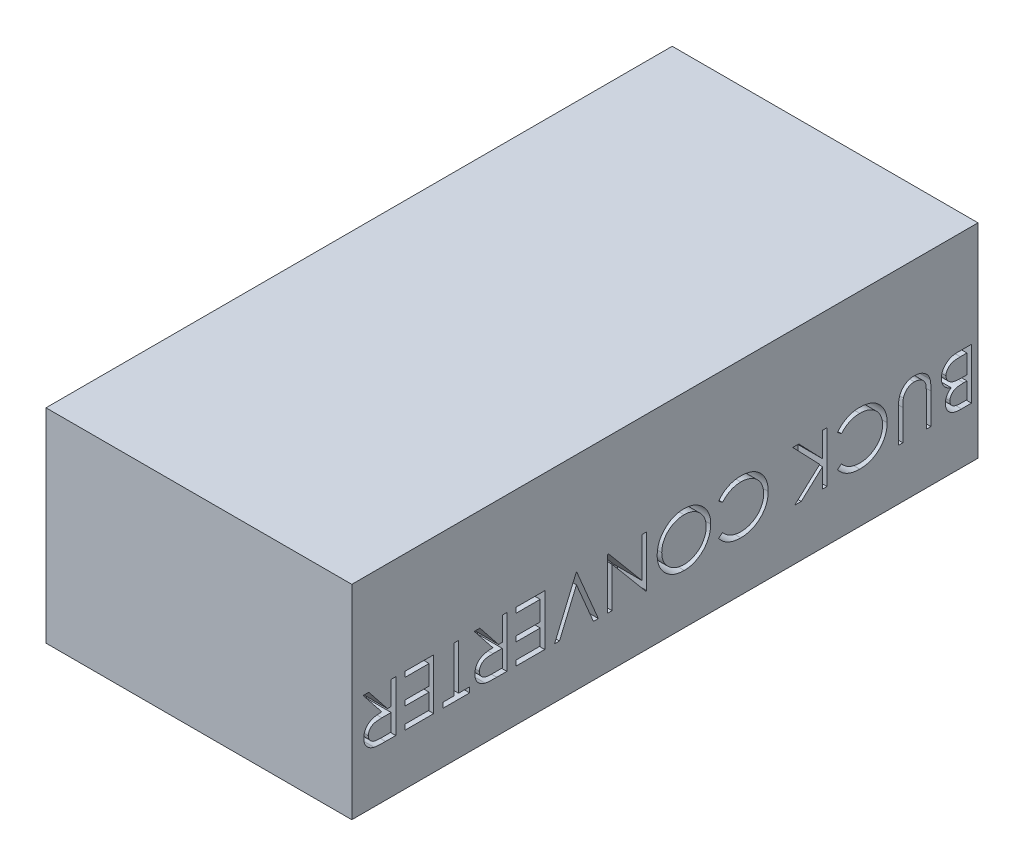
from build123d import *

# Parameters (mm, degrees)
SKETCH1_W           = 21
SKETCH1_H           = 43
BOSS_EXTRUDE1_DEPTH = 14
CUT_EXTRUDE1_DEPTH  = 2


with BuildPart() as part:
    # Sketch1 → Boss-Extrude1 (new body)
    with BuildSketch(Plane(origin=(0, 0, 0), x_dir=(1, 0, 0), z_dir=(0, 1, 0))):
        Rectangle(SKETCH1_W, SKETCH1_H)
    extrude(amount=BOSS_EXTRUDE1_DEPTH)

    # Sketch2 → Cut-Extrude1 (cut)
    # profile 1 of 13: a face of its own
    with BuildSketch(Plane(origin=(10.5, 0, 0), x_dir=(0, 0, -1), z_dir=(1, 0, 0))):
        with BuildLine():
            Line((21.051282051, 3.5), (20.368389423, 3.5))
            add(Edge.make_bspline(
                [(20.368389423, 3.5), (20.334960418, 3.500172984), (20.270166686, 3.500508269), (20.175954408, 3.505829002), (20.087680778, 3.512902413), (20.005501786, 3.52476768), (19.928882705, 3.537070397), (19.85860138, 3.55512784), (19.794069117, 3.575072944), (19.716579078, 3.605761192), (19.628656011, 3.653420429), (19.534155165, 3.724103607), (19.452009264, 3.808847029), (19.382160899, 3.905418843), (19.3261061, 4.011658782), (19.286065965, 4.125281059), (19.260342658, 4.244374116), (19.257730433, 4.326023418), (19.256410256, 4.36728766)],
                knots=[0, 0, 0, 0, 1.00128172, 1.940733171, 2.826250472, 3.653024905, 4.427672124, 5.149348099, 5.824709082, 6.450061444, 7.643590664, 8.808605388, 9.972104426, 11.165284501, 12.367876273, 13.557044126, 14.765369432, 16, 16, 16, 16], degree=3))
            add(Edge.make_bspline(
                [(19.256410256, 4.36728766), (19.257488595, 4.405945152), (19.259607633, 4.481910769), (19.280308915, 4.592646797), (19.311556998, 4.698389778), (19.356649879, 4.798120669), (19.414147093, 4.890963139), (19.484101093, 4.975333531), (19.567047364, 5.049575379), (19.629323882, 5.090892023), (19.660957532, 5.111879006)],
                knots=[0, 0, 0, 0, 1.044356178, 2.052258378, 3.035953355, 4.020338374, 5.002448483, 5.980768927, 6.974322109, 8, 8, 8, 8], degree=3))
            add(Edge.make_bspline(
                [(19.660957532, 5.111879006), (19.621194283, 5.127137161), (19.545117337, 5.156329791), (19.440290155, 5.208141918), (19.349943956, 5.264063583), (19.272914422, 5.324504675), (19.208369116, 5.391438768), (19.150869565, 5.463103107), (19.102071463, 5.541993518), (19.060435796, 5.626400483), (19.027453731, 5.715877014), (19.004559592, 5.80975372), (18.990040056, 5.906967318), (18.988141362, 5.973038748), (18.987179487, 6.006510417)],
                knots=[0, 0, 0, 0, 1.272200328, 2.434034374, 3.488177493, 4.442517805, 5.351202203, 6.260825393, 7.183200622, 8.11705787, 9.069326169, 10.026320267, 11.000137371, 12, 12, 12, 12], degree=3))
            add(Edge.make_bspline(
                [(18.987179487, 6.006510417), (18.988156427, 6.040677232), (18.990078583, 6.107901398), (19.004257216, 6.206657345), (19.028271245, 6.301029308), (19.061324283, 6.391645467), (19.104410582, 6.477975111), (19.156463308, 6.560696694), (19.218937559, 6.638584271), (19.28928971, 6.712768085), (19.36778247, 6.780605978), (19.45427535, 6.838903633), (19.546551628, 6.889257714), (19.645874917, 6.929739572), (19.751540451, 6.961429461), (19.863572984, 6.983339798), (19.981908898, 6.998162279), (20.063119828, 6.999377032), (20.104767628, 7)],
                knots=[0, 0, 0, 0, 0.978522333, 1.925270105, 2.85076145, 3.763600118, 4.682725947, 5.609499657, 6.557784645, 7.537954401, 8.534920712, 9.522742111, 10.520247711, 11.5409147, 12.58930695, 13.675078472, 14.807699069, 16, 16, 16, 16], degree=3))
            Line((20.104767628, 7), (21.051282051, 7))
            Line((21.051282051, 7), (21.051282051, 3.5))
        make_face()
        with BuildLine():
            Line((20.737179487, 3.858974359), (20.737179487, 4.980769231))
            Line((20.737179487, 4.980769231), (20.526141827, 4.980769231))
            add(Edge.make_bspline(
                [(20.526141827, 4.980769231), (20.495292754, 4.980372636), (20.435686058, 4.979606334), (20.349136767, 4.977342054), (20.268999446, 4.971279619), (20.194997971, 4.964867583), (20.127628276, 4.954994401), (20.066665012, 4.942912271), (20.011559933, 4.930246421), (19.94804245, 4.908643943), (19.876002732, 4.87705194), (19.799744047, 4.826823143), (19.731107802, 4.768669055), (19.674486862, 4.699689219), (19.627347874, 4.625197235), (19.595611023, 4.544637613), (19.573482911, 4.46078646), (19.571512992, 4.402958368), (19.570512821, 4.373597756)],
                knots=[0, 0, 0, 0, 1.156584208, 2.234756387, 3.244705828, 4.168772894, 5.018724976, 5.795346628, 6.498686023, 7.135894168, 8.308330183, 9.43588092, 10.547699294, 11.667188675, 12.76860303, 13.837480448, 14.902040606, 16, 16, 16, 16], degree=3))
            add(Edge.make_bspline(
                [(19.570512821, 4.373597756), (19.57100062, 4.354160391), (19.571957493, 4.316031875), (19.580978311, 4.260480817), (19.593426932, 4.207618164), (19.613957809, 4.158868998), (19.638281591, 4.112521538), (19.66945887, 4.070039811), (19.705409142, 4.030272982), (19.747322652, 3.994286964), (19.795028068, 3.961739688), (19.850036584, 3.934645635), (19.910852653, 3.91056748), (19.97874448, 3.892315675), (20.052359721, 3.876470202), (20.132821484, 3.866478135), (20.219644851, 3.860059073), (20.279801452, 3.859343995), (20.310897436, 3.858974359)],
                knots=[0, 0, 0, 0, 0.911412742, 1.787835618, 2.63643285, 3.453173233, 4.262886967, 5.08783453, 5.918594724, 6.773969545, 7.67442701, 8.62112486, 9.645634318, 10.739428598, 11.916091468, 13.177237585, 14.540865421, 16, 16, 16, 16], degree=3))
            Line((20.310897436, 3.858974359), (20.737179487, 3.858974359))
        make_face(mode=Mode.SUBTRACT)
        with BuildLine():
            Line((20.737179487, 5.33974359), (20.737179487, 6.641025641))
            Line((20.737179487, 6.641025641), (20.289863782, 6.641025641))
            add(Edge.make_bspline(
                [(20.289863782, 6.641025641), (20.257848057, 6.640604993), (20.196141968, 6.639794251), (20.106981197, 6.63787047), (20.02478179, 6.630733251), (19.948859351, 6.623890525), (19.879565166, 6.612711512), (19.816225231, 6.60188637), (19.760286259, 6.585956638), (19.69483443, 6.564037046), (19.621627218, 6.529006631), (19.541681488, 6.477491407), (19.47126593, 6.414742066), (19.411523263, 6.342489763), (19.361849855, 6.264740239), (19.327485667, 6.181340468), (19.305219629, 6.095076139), (19.302597219, 6.036091755), (19.301282051, 6.006510417)],
                knots=[0, 0, 0, 0, 1.16016216, 2.236059617, 3.229676189, 4.14889023, 4.996733752, 5.772278665, 6.474820656, 7.101410824, 8.271817372, 9.403828207, 10.537358096, 11.673541442, 12.791884111, 13.865947414, 14.929748409, 16, 16, 16, 16], degree=3))
            add(Edge.make_bspline(
                [(19.301282051, 6.006510417), (19.301550517, 5.988014302), (19.302083119, 5.951320418), (19.310455091, 5.897445038), (19.322073246, 5.844998886), (19.339195144, 5.794694354), (19.359907985, 5.745665208), (19.387233498, 5.699506765), (19.418056476, 5.654254134), (19.465796606, 5.596371008), (19.536181938, 5.530484909), (19.636237171, 5.466784366), (19.749367359, 5.414579785), (19.831612726, 5.392510301), (19.874098558, 5.381109776)],
                knots=[0, 0, 0, 0, 0.723354195, 1.435040621, 2.129761981, 2.824182007, 3.512608497, 4.209435533, 4.920062464, 5.654614313, 7.143585817, 8.671381114, 10.280521501, 12, 12, 12, 12], degree=3))
            add(Edge.make_bspline(
                [(19.874098558, 5.381109776), (19.891127638, 5.377654459), (19.928050196, 5.370162621), (19.988258082, 5.362259384), (20.057224435, 5.355169923), (20.134654481, 5.35006353), (20.220856169, 5.344581907), (20.315801805, 5.342525963), (20.419558513, 5.340016576), (20.491550974, 5.339836913), (20.528946314, 5.33974359)],
                knots=[0, 0, 0, 0, 0.634452549, 1.375623993, 2.216454381, 3.166361212, 4.209414599, 5.370755378, 6.634280627, 8, 8, 8, 8], degree=3))
            Line((20.528946314, 5.33974359), (20.737179487, 5.33974359))
        make_face(mode=Mode.SUBTRACT)
    # profile 2 of 13: a face of its own
    with BuildSketch(Plane(origin=(10.5, 0, 0), x_dir=(0, 0, -1), z_dir=(1, 0, 0))):
        with BuildLine():
            Line((18.269230769, 3.5), (17.955128205, 3.5))
            Line((17.955128205, 3.5), (17.955128205, 5.597055288))
            add(Edge.make_bspline(
                [(17.955128205, 5.597055288), (17.955174949, 5.626736024), (17.955263654, 5.683060335), (17.95467114, 5.763228636), (17.953011772, 5.834501095), (17.951965612, 5.897152442), (17.949638278, 5.95089519), (17.947740232, 5.9960205), (17.945299675, 6.032314703), (17.942366557, 6.053495629), (17.941105769, 6.06260016)],
                knots=[0, 0, 0, 0, 1.528628734, 2.90083645, 4.128790002, 5.200304208, 6.127813768, 6.898992206, 7.526736466, 8, 8, 8, 8], degree=3))
            add(Edge.make_bspline(
                [(17.941105769, 6.06260016), (17.935992373, 6.095701677), (17.926121192, 6.159602666), (17.899800503, 6.250486033), (17.864997624, 6.332829027), (17.820644397, 6.407551663), (17.765940393, 6.475179324), (17.69844651, 6.5363622), (17.618302052, 6.591276556), (17.527329354, 6.639446207), (17.430337919, 6.679397119), (17.330877037, 6.709305362), (17.230846673, 6.727605904), (17.163868855, 6.729719607), (17.130608974, 6.730769231)],
                knots=[0, 0, 0, 0, 1.042923073, 2.013316119, 2.939979093, 3.821796737, 4.712412725, 5.640305549, 6.650442997, 7.732186751, 8.842579391, 9.91407549, 10.964170509, 12, 12, 12, 12], degree=3))
            add(Edge.make_bspline(
                [(17.130608974, 6.730769231), (17.102052672, 6.729701392), (17.045105, 6.727571883), (16.960536728, 6.714220914), (16.877908096, 6.690638524), (16.797886048, 6.6584976), (16.721704703, 6.61903586), (16.651412244, 6.571434275), (16.587748919, 6.51679487), (16.530336519, 6.455373621), (16.480364283, 6.386794141), (16.437345758, 6.311413734), (16.402197347, 6.228631172), (16.38454004, 6.170290699), (16.375500801, 6.140424679)],
                knots=[0, 0, 0, 0, 0.994543961, 1.983343699, 2.972712664, 3.980751554, 4.981834161, 5.954730495, 6.930176574, 7.89761099, 8.875938748, 9.87834379, 10.913868493, 12, 12, 12, 12], degree=3))
            add(Edge.make_bspline(
                [(16.375500801, 6.140424679), (16.372500676, 6.128076105), (16.365815188, 6.100558505), (16.359568143, 6.054037215), (16.353061617, 5.999147851), (16.348547047, 5.935496038), (16.344145827, 5.863295065), (16.341512754, 5.782168808), (16.340295721, 5.692411847), (16.339933041, 5.629774685), (16.33974359, 5.597055288)],
                knots=[0, 0, 0, 0, 0.558680831, 1.244966039, 2.062412453, 2.990489873, 4.051219941, 5.244515665, 6.560634259, 8, 8, 8, 8], degree=3))
            Line((16.33974359, 5.597055288), (16.33974359, 3.5))
            Line((16.33974359, 3.5), (16.025641026, 3.5))
            Line((16.025641026, 3.5), (16.025641026, 5.613882212))
            add(Edge.make_bspline(
                [(16.025641026, 5.613882212), (16.025892372, 5.651980994), (16.02638289, 5.726333084), (16.030722001, 5.83527884), (16.037442871, 5.938651613), (16.047595217, 6.036321365), (16.058828703, 6.128398013), (16.074765444, 6.214544305), (16.091713725, 6.295491065), (16.112983583, 6.371387599), (16.138285268, 6.443379087), (16.168415946, 6.512825305), (16.205113397, 6.57910143), (16.24665256, 6.643422424), (16.293883913, 6.705195523), (16.346404725, 6.764900078), (16.405055613, 6.821751189), (16.468358403, 6.876020652), (16.535799145, 6.926848433), (16.608134461, 6.97012412), (16.684069532, 7.006748991), (16.762799021, 7.037943323), (16.845653573, 7.060754244), (16.931601151, 7.077880318), (17.021245797, 7.08756858), (17.082209703, 7.08901244), (17.113080929, 7.08974359)],
                knots=[0, 0, 0, 0, 1.316485072, 2.56920066, 3.767172097, 4.895413872, 5.962239305, 6.971350037, 7.921780903, 8.819233545, 9.69278517, 10.557066787, 11.431700348, 12.307563454, 13.200791052, 14.11626757, 15.05287325, 16.020813301, 16.99640464, 17.967304965, 18.928075993, 19.907403966, 20.889159767, 21.893313923, 22.933205135, 24, 24, 24, 24], degree=3))
            add(Edge.make_bspline(
                [(17.113080929, 7.08974359), (17.146750278, 7.088959368), (17.212809419, 7.087420729), (17.310144004, 7.078590276), (17.403470893, 7.061999951), (17.493700932, 7.04073864), (17.5799624, 7.011894136), (17.662229875, 6.976451935), (17.741447959, 6.935989276), (17.815831888, 6.888176266), (17.885991858, 6.836039397), (17.949751228, 6.778772763), (18.008728536, 6.718557371), (18.060324194, 6.653125808), (18.106489722, 6.583817519), (18.146207838, 6.510306514), (18.180324311, 6.432691338), (18.19793044, 6.378737711), (18.206830929, 6.35146234)],
                knots=[0, 0, 0, 0, 1.138939089, 2.234594419, 3.301501784, 4.342532435, 5.367382236, 6.373123747, 7.370098489, 8.372230273, 9.360297234, 10.323289009, 11.268038109, 12.20748145, 13.137029304, 14.081414587, 15.030090602, 16, 16, 16, 16], degree=3))
            add(Edge.make_bspline(
                [(18.206830929, 6.35146234), (18.212008088, 6.332829765), (18.223237459, 6.292415296), (18.235262757, 6.225528808), (18.245371838, 6.14851389), (18.254877397, 6.061365272), (18.260486355, 5.964015405), (18.265403793, 5.856506489), (18.269265412, 5.738708528), (18.26924264, 5.656654012), (18.269230769, 5.613882212)],
                knots=[0, 0, 0, 0, 0.625038921, 1.35572334, 2.194682327, 3.136881307, 4.189498639, 5.346923369, 6.617055217, 8, 8, 8, 8], degree=3))
            Line((18.269230769, 5.613882212), (18.269230769, 3.5))
        make_face()
    # profile 3 of 13: a face of its own
    with BuildSketch(Plane(origin=(10.5, 0, 0), x_dir=(0, 0, -1), z_dir=(1, 0, 0))):
        with BuildLine():
            Line((11.852564103, 4.142227564), (12.127403846, 4.352564103))
            add(Edge.make_bspline(
                [(12.127403846, 4.352564103), (12.147009936, 4.329198442), (12.185957782, 4.28278214), (12.24861403, 4.217598054), (12.313926723, 4.156549782), (12.381804985, 4.09924508), (12.453819677, 4.047987144), (12.527226836, 3.998783962), (12.60469367, 3.955704883), (12.711271534, 3.903078399), (12.851237191, 3.849360057), (13.026822033, 3.803157646), (13.210367852, 3.774023468), (13.335560666, 3.770846635), (13.399238782, 3.769230769)],
                knots=[0, 0, 0, 0, 0.75789156, 1.505565099, 2.245254514, 2.979266606, 3.711207489, 4.440978832, 5.174393176, 5.91211879, 7.394186119, 8.890401545, 10.418332761, 12, 12, 12, 12], degree=3))
            add(Edge.make_bspline(
                [(13.399238782, 3.769230769), (13.434321655, 3.769636555), (13.504161799, 3.770444359), (13.607816566, 3.781026584), (13.709732099, 3.79607132), (13.809529409, 3.8178517), (13.907010348, 3.846207777), (14.002917143, 3.879461891), (14.096120296, 3.920843245), (14.187741384, 3.966543484), (14.275516768, 4.018176137), (14.358583926, 4.07447701), (14.436568213, 4.134889919), (14.509667959, 4.1992721), (14.577146571, 4.268375171), (14.639720903, 4.341422716), (14.697311089, 4.418744625), (14.749857706, 4.499971447), (14.796857342, 4.584701948), (14.837613662, 4.672572174), (14.872064716, 4.763246435), (14.900013585, 4.856530407), (14.921887512, 4.952093887), (14.937028928, 5.050279044), (14.947513659, 5.150914255), (14.948314346, 5.219123359), (14.948717949, 5.253505609)],
                knots=[0, 0, 0, 0, 1.054960097, 2.100129169, 3.131228542, 4.15308236, 5.169990287, 6.183953224, 7.204064171, 8.235355279, 9.262684623, 10.264978336, 11.252191258, 12.228402777, 13.192898315, 14.155264692, 15.119862721, 16.091023151, 17.063429752, 18.032246104, 19.00241354, 19.978852882, 20.959535218, 21.948948728, 22.966123959, 24, 24, 24, 24], degree=3))
            add(Edge.make_bspline(
                [(14.948717949, 5.253505609), (14.947453171, 5.305235776), (14.944969948, 5.406801096), (14.922963615, 5.555588077), (14.889254224, 5.698262935), (14.839560183, 5.833859633), (14.777062042, 5.963508531), (14.699081594, 6.085637373), (14.60842475, 6.202035382), (14.504161485, 6.309883465), (14.389752644, 6.408395797), (14.267005534, 6.495146748), (14.136221034, 6.567461533), (13.998844461, 6.627637506), (13.853818331, 6.673894226), (13.701403533, 6.706458351), (13.541931537, 6.727700531), (13.432962137, 6.72973422), (13.377504006, 6.730769231)],
                knots=[0, 0, 0, 0, 1.029159485, 2.020618137, 2.987588728, 3.942669054, 4.889339625, 5.846988364, 6.821327795, 7.821533711, 8.827683044, 9.822769455, 10.807800696, 11.797391277, 12.803701919, 13.832062008, 14.896664671, 16, 16, 16, 16], degree=3))
            add(Edge.make_bspline(
                [(13.377504006, 6.730769231), (13.316401317, 6.729080451), (13.196136608, 6.725756528), (13.019768582, 6.697597279), (12.850932817, 6.651939362), (12.68962023, 6.588041439), (12.536285584, 6.504976151), (12.390688923, 6.404278274), (12.252707353, 6.284989941), (12.169736071, 6.193906813), (12.127403846, 6.147435897)],
                knots=[0, 0, 0, 0, 1.028121516, 2.023589091, 2.998037872, 3.967518031, 4.937445131, 5.927275754, 6.942489185, 8, 8, 8, 8], degree=3))
            Line((12.127403846, 6.147435897), (11.852564103, 6.355669071))
            add(Edge.make_bspline(
                [(11.852564103, 6.355669071), (11.874682959, 6.384206584), (11.918814723, 6.441144917), (11.990261672, 6.521430551), (12.065580314, 6.596882567), (12.144973974, 6.667108013), (12.228546297, 6.732457902), (12.316260755, 6.792628369), (12.407679859, 6.848286885), (12.50291808, 6.898734792), (12.601980632, 6.943625001), (12.70401857, 6.982858942), (12.809218808, 7.015803401), (12.916751757, 7.043483567), (13.027722316, 7.063252493), (13.140860789, 7.078985532), (13.257220564, 7.088321615), (13.335653889, 7.089265346), (13.375400641, 7.08974359)],
                knots=[0, 0, 0, 0, 0.986880684, 1.969034265, 2.935876267, 3.899990983, 4.864973347, 5.834408638, 6.8063673, 7.789580233, 8.778939794, 9.778051223, 10.776304221, 11.791326552, 12.811423977, 13.855999788, 14.91350973, 16, 16, 16, 16], degree=3))
            add(Edge.make_bspline(
                [(13.375400641, 7.08974359), (13.413044308, 7.089481597), (13.487479998, 7.088963539), (13.59737875, 7.080571372), (13.704368331, 7.069121635), (13.808142956, 7.051881504), (13.909268932, 7.031537164), (14.006829516, 7.004265907), (14.101784726, 6.973716741), (14.193753067, 6.937811754), (14.282812767, 6.897295571), (14.368676578, 6.851504013), (14.451305011, 6.800822148), (14.531510431, 6.746367137), (14.608108015, 6.686389836), (14.68176154, 6.621723201), (14.752884017, 6.55258519), (14.796886702, 6.502730337), (14.819010417, 6.477664263)],
                knots=[0, 0, 0, 0, 1.114604814, 2.203992996, 3.262667896, 4.300477797, 5.318619304, 6.316056647, 7.298880507, 8.271930387, 9.238335007, 10.195173496, 11.151986948, 12.108099108, 13.064862484, 14.031167946, 15.010108607, 16, 16, 16, 16], degree=3))
            add(Edge.make_bspline(
                [(14.819010417, 6.477664263), (14.854443749, 6.434122176), (14.924882631, 6.34756368), (15.015042345, 6.207290924), (15.091961258, 6.060964695), (15.154847275, 5.907737447), (15.203151073, 5.747549613), (15.237111783, 5.580658888), (15.259026577, 5.407398896), (15.261541939, 5.289563768), (15.262820513, 5.229667468)],
                knots=[0, 0, 0, 0, 0.994611881, 1.977215934, 2.950189954, 3.921972279, 4.908960509, 5.911694611, 6.938501887, 8, 8, 8, 8], degree=3))
            add(Edge.make_bspline(
                [(15.262820513, 5.229667468), (15.261258363, 5.166714648), (15.258184932, 5.042858906), (15.232288416, 4.861047359), (15.190123887, 4.687109692), (15.132063048, 4.520376633), (15.055465278, 4.361802165), (14.962737484, 4.210716562), (14.852973937, 4.06724319), (14.727553164, 3.933216368), (14.589978582, 3.81068028), (14.442661663, 3.702873223), (14.285879216, 3.613155932), (14.121361498, 3.538159709), (13.94787578, 3.480515263), (13.765792421, 3.440162071), (13.575453504, 3.415044956), (13.445591079, 3.411869748), (13.379607372, 3.41025641)],
                knots=[0, 0, 0, 0, 1.032901378, 2.032168977, 3.007206631, 3.966850309, 4.924221947, 5.891988639, 6.871730993, 7.884084801, 8.900290346, 9.89161143, 10.874607481, 11.860025555, 12.854717796, 13.869097222, 14.917278314, 16, 16, 16, 16], degree=3))
            add(Edge.make_bspline(
                [(13.379607372, 3.41025641), (13.339392953, 3.410738608), (13.259792561, 3.411693069), (13.142039138, 3.420998353), (13.027399645, 3.436515114), (12.915555171, 3.457661883), (12.806321235, 3.483964398), (12.700188742, 3.516898622), (12.597461793, 3.556718275), (12.497447697, 3.601036563), (12.401428802, 3.651792968), (12.309452871, 3.706962898), (12.222266731, 3.767608739), (12.139303629, 3.832845992), (12.06094713, 3.903176518), (11.986021263, 3.977418153), (11.916750743, 4.0575403), (11.873998815, 4.113946801), (11.852564103, 4.142227564)],
                knots=[0, 0, 0, 0, 1.096566765, 2.170543479, 3.218870886, 4.250164525, 5.273529809, 6.281496242, 7.278154839, 8.276706968, 9.263143576, 10.238168486, 11.199979644, 12.157579042, 13.114563119, 14.070017788, 15.032356758, 16, 16, 16, 16], degree=3))
        make_face()
    # profile 4 of 13: a face of its own
    with BuildSketch(Plane(origin=(10.5, 0, 0), x_dir=(0, 0, -1), z_dir=(1, 0, 0))):
        Polygon((11.134615385, 3.5), (10.820512821, 3.5), (10.820512821, 4.832832532), (9.361478365, 3.5), (8.913461538, 3.5), (10.633313301, 5.070512821), (8.778846154, 7), (9.197415865, 7), (10.820512821, 5.310997596), (10.820512821, 7), (11.134615385, 7), align=None)
    # profile 5 of 13: a face of its own
    with BuildSketch(Plane(origin=(10.5, 0, 0), x_dir=(0, 0, -1), z_dir=(1, 0, 0))):
        with BuildLine():
            Line((3.685897436, 4.142227564), (3.960737179, 4.352564103))
            add(Edge.make_bspline(
                [(3.960737179, 4.352564103), (3.980343269, 4.329198442), (4.019291115, 4.28278214), (4.081947364, 4.217598054), (4.147260056, 4.156549782), (4.215138319, 4.09924508), (4.287153011, 4.047987144), (4.36056017, 3.998783962), (4.438027004, 3.955704883), (4.544604867, 3.903078399), (4.684570525, 3.849360057), (4.860155367, 3.803157646), (5.043701185, 3.774023468), (5.168893999, 3.770846635), (5.232572115, 3.769230769)],
                knots=[0, 0, 0, 0, 0.75789156, 1.505565099, 2.245254514, 2.979266606, 3.711207489, 4.440978832, 5.174393176, 5.91211879, 7.394186119, 8.890401545, 10.418332761, 12, 12, 12, 12], degree=3))
            add(Edge.make_bspline(
                [(5.232572115, 3.769230769), (5.267654988, 3.769636555), (5.337495132, 3.770444359), (5.441149899, 3.781026584), (5.543065432, 3.79607132), (5.642862743, 3.8178517), (5.740343681, 3.846207777), (5.836250477, 3.879461891), (5.92945363, 3.920843245), (6.021074717, 3.966543484), (6.108850102, 4.018176137), (6.191917259, 4.07447701), (6.269901546, 4.134889919), (6.343001292, 4.1992721), (6.410479904, 4.268375171), (6.473054237, 4.341422716), (6.530644422, 4.418744625), (6.58319104, 4.499971447), (6.630190675, 4.584701948), (6.670946995, 4.672572174), (6.705398049, 4.763246435), (6.733346918, 4.856530407), (6.755220846, 4.952093887), (6.770362262, 5.050279044), (6.780846992, 5.150914255), (6.781647679, 5.219123359), (6.782051282, 5.253505609)],
                knots=[0, 0, 0, 0, 1.054960097, 2.100129169, 3.131228542, 4.15308236, 5.169990287, 6.183953224, 7.204064171, 8.235355279, 9.262684623, 10.264978336, 11.252191258, 12.228402777, 13.192898315, 14.155264692, 15.119862721, 16.091023151, 17.063429752, 18.032246104, 19.00241354, 19.978852882, 20.959535218, 21.948948728, 22.966123959, 24, 24, 24, 24], degree=3))
            add(Edge.make_bspline(
                [(6.782051282, 5.253505609), (6.780786504, 5.305235776), (6.778303281, 5.406801096), (6.756296948, 5.555588077), (6.722587557, 5.698262935), (6.672893516, 5.833859633), (6.610395375, 5.963508531), (6.532414928, 6.085637373), (6.441758083, 6.202035382), (6.337494818, 6.309883465), (6.223085977, 6.408395797), (6.100338867, 6.495146748), (5.969554367, 6.567461533), (5.832177794, 6.627637506), (5.687151665, 6.673894226), (5.534736867, 6.706458351), (5.37526487, 6.727700531), (5.26629547, 6.72973422), (5.21083734, 6.730769231)],
                knots=[0, 0, 0, 0, 1.029159485, 2.020618137, 2.987588728, 3.942669054, 4.889339625, 5.846988364, 6.821327795, 7.821533711, 8.827683044, 9.822769455, 10.807800696, 11.797391277, 12.803701919, 13.832062008, 14.896664671, 16, 16, 16, 16], degree=3))
            add(Edge.make_bspline(
                [(5.21083734, 6.730769231), (5.149734651, 6.729080451), (5.029469942, 6.725756528), (4.853101915, 6.697597279), (4.68426615, 6.651939362), (4.522953563, 6.588041439), (4.369618917, 6.504976151), (4.224022257, 6.404278274), (4.086040686, 6.284989941), (4.003069404, 6.193906813), (3.960737179, 6.147435897)],
                knots=[0, 0, 0, 0, 1.028121516, 2.023589091, 2.998037872, 3.967518031, 4.937445131, 5.927275754, 6.942489185, 8, 8, 8, 8], degree=3))
            Line((3.960737179, 6.147435897), (3.685897436, 6.355669071))
            add(Edge.make_bspline(
                [(3.685897436, 6.355669071), (3.708016292, 6.384206584), (3.752148056, 6.441144917), (3.823595006, 6.521430551), (3.898913647, 6.596882567), (3.978307308, 6.667108013), (4.06187963, 6.732457902), (4.149594088, 6.792628369), (4.241013192, 6.848286885), (4.336251414, 6.898734792), (4.435313965, 6.943625001), (4.537351903, 6.982858942), (4.642552141, 7.015803401), (4.75008509, 7.043483567), (4.861055649, 7.063252493), (4.974194122, 7.078985532), (5.090553898, 7.088321615), (5.168987223, 7.089265346), (5.208733974, 7.08974359)],
                knots=[0, 0, 0, 0, 0.986880684, 1.969034265, 2.935876267, 3.899990983, 4.864973347, 5.834408638, 6.8063673, 7.789580233, 8.778939794, 9.778051223, 10.776304221, 11.791326552, 12.811423977, 13.855999788, 14.91350973, 16, 16, 16, 16], degree=3))
            add(Edge.make_bspline(
                [(5.208733974, 7.08974359), (5.246377641, 7.089481597), (5.320813332, 7.088963539), (5.430712083, 7.080571372), (5.537701664, 7.069121635), (5.64147629, 7.051881504), (5.742602265, 7.031537164), (5.840162849, 7.004265907), (5.93511806, 6.973716741), (6.0270864, 6.937811754), (6.1161461, 6.897295571), (6.202009912, 6.851504013), (6.284638344, 6.800822148), (6.364843765, 6.746367137), (6.441441348, 6.686389836), (6.515094874, 6.621723201), (6.58621735, 6.55258519), (6.630220035, 6.502730337), (6.65234375, 6.477664263)],
                knots=[0, 0, 0, 0, 1.114604814, 2.203992996, 3.262667896, 4.300477797, 5.318619304, 6.316056647, 7.298880507, 8.271930387, 9.238335007, 10.195173496, 11.151986948, 12.108099108, 13.064862484, 14.031167946, 15.010108607, 16, 16, 16, 16], degree=3))
            add(Edge.make_bspline(
                [(6.65234375, 6.477664263), (6.687777082, 6.434122176), (6.758215964, 6.34756368), (6.848375678, 6.207290924), (6.925294591, 6.060964695), (6.988180608, 5.907737447), (7.036484406, 5.747549613), (7.070445116, 5.580658888), (7.092359911, 5.407398896), (7.094875273, 5.289563768), (7.096153846, 5.229667468)],
                knots=[0, 0, 0, 0, 0.994611881, 1.977215934, 2.950189954, 3.921972279, 4.908960509, 5.911694611, 6.938501887, 8, 8, 8, 8], degree=3))
            add(Edge.make_bspline(
                [(7.096153846, 5.229667468), (7.094591697, 5.166714648), (7.091518265, 5.042858906), (7.06562175, 4.861047359), (7.02345722, 4.687109692), (6.965396381, 4.520376633), (6.888798612, 4.361802165), (6.796070817, 4.210716562), (6.686307271, 4.06724319), (6.560886498, 3.933216368), (6.423311915, 3.81068028), (6.275994996, 3.702873223), (6.119212549, 3.613155932), (5.954694832, 3.538159709), (5.781209114, 3.480515263), (5.599125755, 3.440162071), (5.408786837, 3.415044956), (5.278924412, 3.411869748), (5.212940705, 3.41025641)],
                knots=[0, 0, 0, 0, 1.032901378, 2.032168977, 3.007206631, 3.966850309, 4.924221947, 5.891988639, 6.871730993, 7.884084801, 8.900290346, 9.89161143, 10.874607481, 11.860025555, 12.854717796, 13.869097222, 14.917278314, 16, 16, 16, 16], degree=3))
            add(Edge.make_bspline(
                [(5.212940705, 3.41025641), (5.172726286, 3.410738608), (5.093125894, 3.411693069), (4.975372471, 3.420998353), (4.860732978, 3.436515114), (4.748888504, 3.457661883), (4.639654568, 3.483964398), (4.533522076, 3.516898622), (4.430795127, 3.556718275), (4.33078103, 3.601036563), (4.234762136, 3.651792968), (4.142786205, 3.706962898), (4.055600064, 3.767608739), (3.972636963, 3.832845992), (3.894280463, 3.903176518), (3.819354597, 3.977418153), (3.750084076, 4.0575403), (3.707332148, 4.113946801), (3.685897436, 4.142227564)],
                knots=[0, 0, 0, 0, 1.096566765, 2.170543479, 3.218870886, 4.250164525, 5.273529809, 6.281496242, 7.278154839, 8.276706968, 9.263143576, 10.238168486, 11.199979644, 12.157579042, 13.114563119, 14.070017788, 15.032356758, 16, 16, 16, 16], degree=3))
        make_face()
    # profile 6 of 13: a face of its own
    with BuildSketch(Plane(origin=(10.5, 0, 0), x_dir=(0, 0, -1), z_dir=(1, 0, 0))):
        with BuildLine():
            add(Edge.make_bspline(
                [(1.330128205, 3.41025641), (1.265313046, 3.411870271), (1.138010726, 3.415040027), (0.95108902, 3.4401046), (0.772103957, 3.481359397), (0.600948636, 3.539616026), (0.438288719, 3.615152641), (0.283609945, 3.706855788), (0.137443989, 3.815626727), (0.000168897, 3.938883425), (-0.124600887, 4.074368288), (-0.233170818, 4.219820832), (-0.325573955, 4.372313506), (-0.401070621, 4.532839394), (-0.460393291, 4.700681799), (-0.501305774, 4.876840591), (-0.527445717, 5.060145972), (-0.530501248, 5.185173017), (-0.532051282, 5.248597756)],
                knots=[0, 0, 0, 0, 1.065027606, 2.091802087, 3.093458616, 4.079833113, 5.057734272, 6.036020118, 7.030157768, 8.047461502, 9.064242947, 10.052216774, 11.02588392, 11.989864716, 12.962978571, 13.945936472, 14.957997893, 16, 16, 16, 16], degree=3))
            add(Edge.make_bspline(
                [(-0.532051282, 5.248597756), (-0.530500728, 5.311554931), (-0.527444408, 5.435650815), (-0.501284535, 5.61779816), (-0.460210842, 5.792874535), (-0.401804498, 5.960472738), (-0.326252221, 6.120675058), (-0.233703687, 6.273274426), (-0.12537768, 6.419151093), (-0.001119457, 6.555295487), (0.134571538, 6.680076781), (0.279125438, 6.79038532), (0.432367811, 6.882278659), (0.591906918, 6.958903934), (0.759330528, 7.016937345), (0.933457844, 7.059227344), (1.115276184, 7.085103848), (1.23913099, 7.088180038), (1.302083333, 7.08974359)],
                knots=[0, 0, 0, 0, 1.043683505, 2.0572211, 3.045299494, 4.022276905, 4.994977706, 5.977452478, 6.97747046, 8.003698437, 9.029677512, 10.031249186, 11.013723958, 11.988083691, 12.9614021, 13.946617861, 14.956316495, 16, 16, 16, 16], degree=3))
            add(Edge.make_bspline(
                [(1.302083333, 7.08974359), (1.365507776, 7.088194411), (1.490534237, 7.085140567), (1.674069494, 7.05895618), (1.850353759, 7.01802581), (2.018844255, 6.959476378), (2.179596273, 6.884092975), (2.332594268, 6.791457967), (2.478022089, 6.682300333), (2.61439984, 6.55813969), (2.739030669, 6.422708891), (2.848650679, 6.278344793), (2.940751627, 6.126420381), (3.016166853, 5.967561916), (3.075817425, 5.802180021), (3.116526013, 5.629234381), (3.142860942, 5.449694105), (3.145895929, 5.327451313), (3.147435897, 5.265424679)],
                knots=[0, 0, 0, 0, 1.053167129, 2.076072758, 3.073341244, 4.055601477, 5.033424535, 6.017524495, 7.021518915, 8.049444456, 9.077120685, 10.074910483, 11.055688766, 12.022980584, 12.991883888, 13.970269434, 14.970104079, 16, 16, 16, 16], degree=3))
            add(Edge.make_bspline(
                [(3.147435897, 5.265424679), (3.146901752, 5.22379182), (3.1458402, 5.141051318), (3.133041294, 5.018187518), (3.114506627, 4.897286367), (3.087804597, 4.778754278), (3.053361243, 4.662571894), (3.010915653, 4.548976814), (2.96227299, 4.437033349), (2.904357181, 4.328871982), (2.841169299, 4.224322946), (2.772269264, 4.124693539), (2.69717667, 4.031763411), (2.616964199, 3.944039325), (2.53052153, 3.863018531), (2.439149622, 3.78693459), (2.342370377, 3.716575093), (2.240030735, 3.653417785), (2.134739885, 3.59540703), (2.025733935, 3.546972824), (1.915312803, 3.50416348), (1.802503856, 3.470142747), (1.687568038, 3.443068845), (1.570361669, 3.424672813), (1.451005468, 3.411845468), (1.370593984, 3.410788375), (1.330128205, 3.41025641)],
                knots=[0, 0, 0, 0, 1.037115869, 2.061148057, 3.07517727, 4.084041727, 5.086514338, 6.092668487, 7.104487461, 8.125783165, 9.147610153, 10.147694368, 11.141876323, 12.122903372, 13.107606018, 14.091946891, 15.084523921, 16.086505767, 17.087268121, 18.077809654, 19.05670789, 20.036870126, 21.011670792, 21.99694167, 22.991993299, 24, 24, 24, 24], degree=3))
        make_face()
        with BuildLine():
            add(Edge.make_bspline(
                [(1.314703526, 3.769230769), (1.34791866, 3.769634054), (1.41403139, 3.770436767), (1.51230852, 3.781076227), (1.60932834, 3.796116711), (1.704877698, 3.81801668), (1.799042043, 3.846077464), (1.891925897, 3.880728514), (1.983612203, 3.921181269), (2.073262539, 3.968137826), (2.159445153, 4.020771252), (2.242677883, 4.076264358), (2.319781971, 4.137762419), (2.392246706, 4.202984864), (2.459896281, 4.272829714), (2.522739733, 4.346782452), (2.58071515, 4.42517788), (2.633127604, 4.507689361), (2.679770451, 4.59385729), (2.721531787, 4.682034219), (2.756150332, 4.773256488), (2.783573379, 4.866954822), (2.806849262, 4.962716319), (2.821449619, 5.06106272), (2.832191016, 5.161654991), (2.832949629, 5.229637232), (2.833333333, 5.264022436)],
                knots=[0, 0, 0, 0, 1.008431664, 2.007222653, 2.999229743, 3.989431819, 4.982149843, 5.98167215, 6.998687425, 8.024288174, 9.053028776, 10.065052016, 11.06063401, 12.045759335, 13.024701188, 14.011819507, 14.991481775, 15.984022113, 16.97831254, 17.965966747, 18.945551853, 19.938269878, 20.93007375, 21.936103907, 22.956087853, 24, 24, 24, 24], degree=3))
            add(Edge.make_bspline(
                [(2.833333333, 5.264022436), (2.832055555, 5.314583507), (2.829541768, 5.414052776), (2.807625815, 5.559837321), (2.773599131, 5.700078846), (2.724266868, 5.833941455), (2.661333832, 5.962022079), (2.584568304, 6.083822274), (2.493267274, 6.19930611), (2.389618321, 6.307613927), (2.276280923, 6.406431406), (2.155990968, 6.49329249), (2.029700147, 6.566397201), (1.898136366, 6.627511096), (1.760176357, 6.673551763), (1.616704667, 6.706378736), (1.467718123, 6.727654831), (1.366192428, 6.729721246), (1.314703526, 6.730769231)],
                knots=[0, 0, 0, 0, 1.032022337, 2.030307203, 3.003823408, 3.974715386, 4.937372378, 5.913284036, 6.909147208, 7.938749767, 8.970518239, 9.975863271, 10.963918693, 11.946286286, 12.933361397, 13.927862637, 14.949112547, 16, 16, 16, 16], degree=3))
            add(Edge.make_bspline(
                [(1.314703526, 6.730769231), (1.280093887, 6.730294111), (1.211452578, 6.729351807), (1.109359066, 6.719847488), (1.00909531, 6.704636794), (0.910846886, 6.682627954), (0.814483872, 6.655448664), (0.72030147, 6.621730312), (0.628314315, 6.581329596), (0.538132815, 6.536232093), (0.451710295, 6.485370567), (0.37002818, 6.429486216), (0.292549313, 6.370075386), (0.220216845, 6.305325278), (0.152849694, 6.236069603), (0.091129397, 6.161803981), (0.033181012, 6.083995832), (-0.01886383, 6.001505325), (-0.066146526, 5.916019213), (-0.106681064, 5.82758559), (-0.141319501, 5.736764562), (-0.169236606, 5.643466504), (-0.191125146, 5.547907407), (-0.206204231, 5.449948853), (-0.216752895, 5.349789639), (-0.217547942, 5.282045766), (-0.217948718, 5.247896635)],
                knots=[0, 0, 0, 0, 1.047362266, 2.077233941, 3.100744636, 4.115120168, 5.122788643, 6.129711893, 7.140355774, 8.162227187, 9.180148637, 10.17298275, 11.156396779, 12.133377858, 13.108923632, 14.078087502, 15.054351192, 16.043448276, 17.028082865, 18.009331763, 18.985518559, 19.968016174, 20.954783108, 21.950335389, 22.966780876, 24, 24, 24, 24], degree=3))
            add(Edge.make_bspline(
                [(-0.217948718, 5.247896635), (-0.217547605, 5.21398113), (-0.216751923, 5.14670348), (-0.206209449, 5.047242662), (-0.191108559, 4.94998945), (-0.16934585, 4.855325648), (-0.141295698, 4.763227121), (-0.106708363, 4.673780379), (-0.065923078, 4.586652163), (-0.0191148, 4.502057945), (0.033500823, 4.420882913), (0.090995809, 4.343281591), (0.154358384, 4.27070478), (0.221794781, 4.201385307), (0.294926302, 4.136709648), (0.373765769, 4.076927916), (0.456349953, 4.019345713), (0.544547318, 3.968387264), (0.635241018, 3.921082365), (0.728398278, 3.880757608), (0.822854172, 3.845923548), (0.918734857, 3.818137532), (1.015874706, 3.796095437), (1.11430071, 3.781081677), (1.213976322, 3.770435624), (1.281021244, 3.769633662), (1.314703526, 3.769230769)],
                knots=[0, 0, 0, 0, 1.02988216, 2.042960975, 3.035124439, 4.018561492, 4.99104521, 5.957523397, 6.929462691, 7.91146347, 8.892205782, 9.866320947, 10.842813644, 11.816825305, 12.802668543, 13.805243666, 14.821427616, 15.858893029, 16.897256944, 17.927432741, 18.940436917, 19.95373962, 20.957947499, 21.96413624, 22.977215056, 24, 24, 24, 24], degree=3))
        make_face(mode=Mode.SUBTRACT)
    # profile 7 of 13: a face of its own
    with BuildSketch(Plane(origin=(10.5, 0, 0), x_dir=(0, 0, -1), z_dir=(1, 0, 0))):
        Polygon((-1.25, 7), (-1.25, 3.5), (-1.315905449, 3.5), (-3.628205128, 6.254707532), (-3.628205128, 3.5), (-3.942307692, 3.5), (-3.942307692, 7), (-3.870793269, 7), (-1.564102564, 4.251602564), (-1.564102564, 7), align=None)
    # profile 8 of 13: a face of its own
    with BuildSketch(Plane(origin=(10.5, 0, 0), x_dir=(0, 0, -1), z_dir=(1, 0, 0))):
        Polygon((-4.570512821, 3.5), (-4.907051282, 3.5), (-6.073717949, 6.258213141), (-7.240384615, 3.5), (-7.576923077, 3.5), (-6.096153846, 7), (-6.051282051, 7), align=None)
    # profile 9 of 13: a face of its own
    with BuildSketch(Plane(origin=(10.5, 0, 0), x_dir=(0, 0, -1), z_dir=(1, 0, 0))):
        Polygon((-8.25, 3.5), (-10.224358974, 3.5), (-10.224358974, 3.858974359), (-8.564102564, 3.858974359), (-8.564102564, 4.935897436), (-10.224358974, 4.935897436), (-10.224358974, 5.294871795), (-8.564102564, 5.294871795), (-8.564102564, 6.641025641), (-10.224358974, 6.641025641), (-10.224358974, 7), (-8.25, 7), align=None)
    # profile 10 of 13: a face of its own
    with BuildSketch(Plane(origin=(10.5, 0, 0), x_dir=(0, 0, -1), z_dir=(1, 0, 0))):
        with BuildLine():
            Line((-10.852564103, 3.5), (-11.552984776, 3.5))
            add(Edge.make_bspline(
                [(-11.552984776, 3.5), (-11.599725904, 3.500155586), (-11.689474049, 3.500454328), (-11.818047319, 3.502120091), (-11.934874416, 3.506894447), (-12.039894255, 3.51100303), (-12.13310491, 3.518494972), (-12.214792201, 3.525655619), (-12.284579898, 3.53502928), (-12.32682575, 3.543734703), (-12.345953526, 3.547676282)],
                knots=[0, 0, 0, 0, 1.410062039, 2.707475311, 3.878576406, 4.937260626, 5.877586885, 6.699081471, 7.410979367, 8, 8, 8, 8], degree=3))
            add(Edge.make_bspline(
                [(-12.345953526, 3.547676282), (-12.371560581, 3.554002347), (-12.422228423, 3.566519524), (-12.495172235, 3.592989289), (-12.564709635, 3.623571417), (-12.630585978, 3.659765615), (-12.692784, 3.700960698), (-12.751297436, 3.747322273), (-12.805341734, 3.799247563), (-12.856839709, 3.854585618), (-12.901807278, 3.915745789), (-12.942290019, 3.979624361), (-12.976273893, 4.047451153), (-13.003015409, 4.118884064), (-13.025433605, 4.193222373), (-13.040500726, 4.271200643), (-13.049884792, 4.352565172), (-13.050811938, 4.407926458), (-13.051282051, 4.435997596)],
                knots=[0, 0, 0, 0, 1.027276577, 2.032638556, 3.019345632, 3.985365262, 4.957888996, 5.923693931, 6.890056973, 7.876427719, 8.865527834, 9.843495157, 10.821038291, 11.815616373, 12.812734995, 13.843357168, 14.906466538, 16, 16, 16, 16], degree=3))
            add(Edge.make_bspline(
                [(-13.051282051, 4.435997596), (-13.049813091, 4.482632754), (-13.04694677, 4.573630027), (-13.020221134, 4.705690159), (-12.976446561, 4.828882215), (-12.916116098, 4.943034754), (-12.839323174, 5.045982774), (-12.747035542, 5.136099546), (-12.639724508, 5.212207266), (-12.539355953, 5.264423869), (-12.45065357, 5.29802227), (-12.3774139, 5.321780902), (-12.297461136, 5.339827879), (-12.211942321, 5.356230059), (-12.120196901, 5.368746241), (-12.022409627, 5.377635108), (-11.918335928, 5.383350718), (-11.846996166, 5.384185793), (-11.810296474, 5.384615385)],
                knots=[0, 0, 0, 0, 1.260402266, 2.459371274, 3.627181936, 4.786749125, 5.93865593, 7.087644312, 8.261344208, 9.485713728, 10.136162886, 10.825977872, 11.566646758, 12.35154167, 13.181268117, 14.0701832, 15.007234106, 16, 16, 16, 16], degree=3))
            Line((-11.810296474, 5.384615385), (-13.096153846, 7))
            Line((-13.096153846, 7), (-12.707732372, 7))
            Line((-12.707732372, 7), (-11.421875, 5.384615385))
            Line((-11.421875, 5.384615385), (-11.166666667, 5.384615385))
            Line((-11.166666667, 5.384615385), (-11.166666667, 7))
            Line((-11.166666667, 7), (-10.852564103, 7))
            Line((-10.852564103, 7), (-10.852564103, 3.5))
        make_face()
        with BuildLine():
            Line((-11.166666667, 3.858974359), (-11.166666667, 5.025641026))
            Line((-11.166666667, 5.025641026), (-11.807491987, 5.030548878))
            add(Edge.make_bspline(
                [(-11.807491987, 5.030548878), (-11.83741203, 5.030562122), (-11.895405594, 5.030587794), (-11.979306208, 5.026593915), (-12.057426494, 5.022050946), (-12.129466666, 5.015100433), (-12.195462147, 5.006148199), (-12.255369345, 4.994932695), (-12.309320648, 4.981921429), (-12.37204329, 4.961577311), (-12.442888617, 4.930735511), (-12.518293937, 4.882912619), (-12.58423373, 4.825077881), (-12.639055388, 4.758108357), (-12.683088206, 4.684160163), (-12.71367292, 4.604906854), (-12.733828068, 4.521597146), (-12.736049468, 4.46439503), (-12.737179487, 4.435296474)],
                knots=[0, 0, 0, 0, 1.146399208, 2.222048177, 3.218135709, 4.144938032, 4.994811973, 5.769438708, 6.479732432, 7.119818093, 8.294689872, 9.430121864, 10.527913442, 11.641375077, 12.733452768, 13.811150417, 14.886538365, 16, 16, 16, 16], degree=3))
            add(Edge.make_bspline(
                [(-12.737179487, 4.435296474), (-12.73599225, 4.407144396), (-12.733639581, 4.35135725), (-12.713993833, 4.269870116), (-12.681915439, 4.192386547), (-12.638008351, 4.119972767), (-12.583361271, 4.054726929), (-12.519709731, 3.999072136), (-12.448551591, 3.95283572), (-12.382583367, 3.92232882), (-12.323188732, 3.904378513), (-12.27185719, 3.891348404), (-12.213351251, 3.882222707), (-12.148359522, 3.873829503), (-12.076596498, 3.866721746), (-11.998018449, 3.862003966), (-11.912681556, 3.859184142), (-11.853534641, 3.859045914), (-11.822916667, 3.858974359)],
                knots=[0, 0, 0, 0, 1.100596872, 2.180981401, 3.259506136, 4.371595435, 5.481727359, 6.576991111, 7.667816242, 8.793363246, 9.406619729, 10.09427138, 10.864108636, 11.721733836, 12.6590937, 13.685439239, 14.801845161, 16, 16, 16, 16], degree=3))
            Line((-11.822916667, 3.858974359), (-11.166666667, 3.858974359))
        make_face(mode=Mode.SUBTRACT)
    # profile 11 of 13: a face of its own
    with BuildSketch(Plane(origin=(10.5, 0, 0), x_dir=(0, 0, -1), z_dir=(1, 0, 0))):
        Polygon((-13.41025641, 3.858974359), (-13.41025641, 3.5), (-15.25, 3.5), (-15.25, 3.858974359), (-14.487179487, 3.858974359), (-14.487179487, 7), (-14.173076923, 7), (-14.173076923, 3.858974359), align=None)
    # profile 12 of 13: a face of its own
    with BuildSketch(Plane(origin=(10.5, 0, 0), x_dir=(0, 0, -1), z_dir=(1, 0, 0))):
        Polygon((-15.878205128, 3.5), (-17.852564103, 3.5), (-17.852564103, 3.858974359), (-16.192307692, 3.858974359), (-16.192307692, 4.935897436), (-17.852564103, 4.935897436), (-17.852564103, 5.294871795), (-16.192307692, 5.294871795), (-16.192307692, 6.641025641), (-17.852564103, 6.641025641), (-17.852564103, 7), (-15.878205128, 7), align=None)
    # profile 13 of 13: a face of its own
    with BuildSketch(Plane(origin=(10.5, 0, 0), x_dir=(0, 0, -1), z_dir=(1, 0, 0))):
        with BuildLine():
            Line((-18.480769231, 3.5), (-19.181189904, 3.5))
            add(Edge.make_bspline(
                [(-19.181189904, 3.5), (-19.227931032, 3.500155586), (-19.317679177, 3.500454328), (-19.446252447, 3.502120091), (-19.563079544, 3.506894447), (-19.668099383, 3.51100303), (-19.761310038, 3.518494972), (-19.842997329, 3.525655619), (-19.912785027, 3.53502928), (-19.955030878, 3.543734703), (-19.974158654, 3.547676282)],
                knots=[0, 0, 0, 0, 1.410062039, 2.707475311, 3.878576406, 4.937260626, 5.877586885, 6.699081471, 7.410979367, 8, 8, 8, 8], degree=3))
            add(Edge.make_bspline(
                [(-19.974158654, 3.547676282), (-19.999765709, 3.554002347), (-20.050433552, 3.566519524), (-20.123377363, 3.592989289), (-20.192914763, 3.623571417), (-20.258791106, 3.659765615), (-20.320989128, 3.700960698), (-20.379502564, 3.747322273), (-20.433546863, 3.799247563), (-20.485044837, 3.854585618), (-20.530012406, 3.915745789), (-20.570495147, 3.979624361), (-20.604479021, 4.047451153), (-20.631220537, 4.118884064), (-20.653638733, 4.193222373), (-20.668705854, 4.271200643), (-20.678089921, 4.352565172), (-20.679017067, 4.407926458), (-20.679487179, 4.435997596)],
                knots=[0, 0, 0, 0, 1.027276577, 2.032638556, 3.019345632, 3.985365262, 4.957888996, 5.923693931, 6.890056973, 7.876427719, 8.865527834, 9.843495157, 10.821038291, 11.815616373, 12.812734995, 13.843357168, 14.906466538, 16, 16, 16, 16], degree=3))
            add(Edge.make_bspline(
                [(-20.679487179, 4.435997596), (-20.67801822, 4.482632754), (-20.675151898, 4.573630027), (-20.648426262, 4.705690159), (-20.60465169, 4.828882215), (-20.544321226, 4.943034754), (-20.467528302, 5.045982774), (-20.37524067, 5.136099546), (-20.267929636, 5.212207266), (-20.167561082, 5.264423869), (-20.078858698, 5.29802227), (-20.005619028, 5.321780902), (-19.925666264, 5.339827879), (-19.840147449, 5.356230059), (-19.748402029, 5.368746241), (-19.650614755, 5.377635108), (-19.546541056, 5.383350718), (-19.475201295, 5.384185793), (-19.438501603, 5.384615385)],
                knots=[0, 0, 0, 0, 1.260402266, 2.459371274, 3.627181936, 4.786749125, 5.93865593, 7.087644312, 8.261344208, 9.485713728, 10.136162886, 10.825977872, 11.566646758, 12.35154167, 13.181268117, 14.0701832, 15.007234106, 16, 16, 16, 16], degree=3))
            Line((-19.438501603, 5.384615385), (-20.724358974, 7))
            Line((-20.724358974, 7), (-20.3359375, 7))
            Line((-20.3359375, 7), (-19.050080128, 5.384615385))
            Line((-19.050080128, 5.384615385), (-18.794871795, 5.384615385))
            Line((-18.794871795, 5.384615385), (-18.794871795, 7))
            Line((-18.794871795, 7), (-18.480769231, 7))
            Line((-18.480769231, 7), (-18.480769231, 3.5))
        make_face()
        with BuildLine():
            Line((-18.794871795, 3.858974359), (-18.794871795, 5.025641026))
            Line((-18.794871795, 5.025641026), (-19.435697115, 5.030548878))
            add(Edge.make_bspline(
                [(-19.435697115, 5.030548878), (-19.465617158, 5.030562122), (-19.523610723, 5.030587794), (-19.607511336, 5.026593915), (-19.685631622, 5.022050946), (-19.757671794, 5.015100433), (-19.823667275, 5.006148199), (-19.883574473, 4.994932695), (-19.937525776, 4.981921429), (-20.000248418, 4.961577311), (-20.071093745, 4.930735511), (-20.146499065, 4.882912619), (-20.212438858, 4.825077881), (-20.267260516, 4.758108357), (-20.311293334, 4.684160163), (-20.341878048, 4.604906854), (-20.362033196, 4.521597146), (-20.364254596, 4.46439503), (-20.365384615, 4.435296474)],
                knots=[0, 0, 0, 0, 1.146399208, 2.222048177, 3.218135709, 4.144938032, 4.994811973, 5.769438708, 6.479732432, 7.119818093, 8.294689872, 9.430121864, 10.527913442, 11.641375077, 12.733452768, 13.811150417, 14.886538365, 16, 16, 16, 16], degree=3))
            add(Edge.make_bspline(
                [(-20.365384615, 4.435296474), (-20.364197379, 4.407144396), (-20.361844709, 4.35135725), (-20.342198961, 4.269870116), (-20.310120567, 4.192386547), (-20.266213479, 4.119972767), (-20.211566399, 4.054726929), (-20.147914859, 3.999072136), (-20.07675672, 3.95283572), (-20.010788495, 3.92232882), (-19.95139386, 3.904378513), (-19.900062318, 3.891348404), (-19.84155638, 3.882222707), (-19.77656465, 3.873829503), (-19.704801627, 3.866721746), (-19.626223577, 3.862003966), (-19.540886684, 3.859184142), (-19.481739769, 3.859045914), (-19.451121795, 3.858974359)],
                knots=[0, 0, 0, 0, 1.100596872, 2.180981401, 3.259506136, 4.371595435, 5.481727359, 6.576991111, 7.667816242, 8.793363246, 9.406619729, 10.09427138, 10.864108636, 11.721733836, 12.6590937, 13.685439239, 14.801845161, 16, 16, 16, 16], degree=3))
            Line((-19.451121795, 3.858974359), (-18.794871795, 3.858974359))
        make_face(mode=Mode.SUBTRACT)
    extrude(amount=-CUT_EXTRUDE1_DEPTH, mode=Mode.SUBTRACT)


solid = part.part
